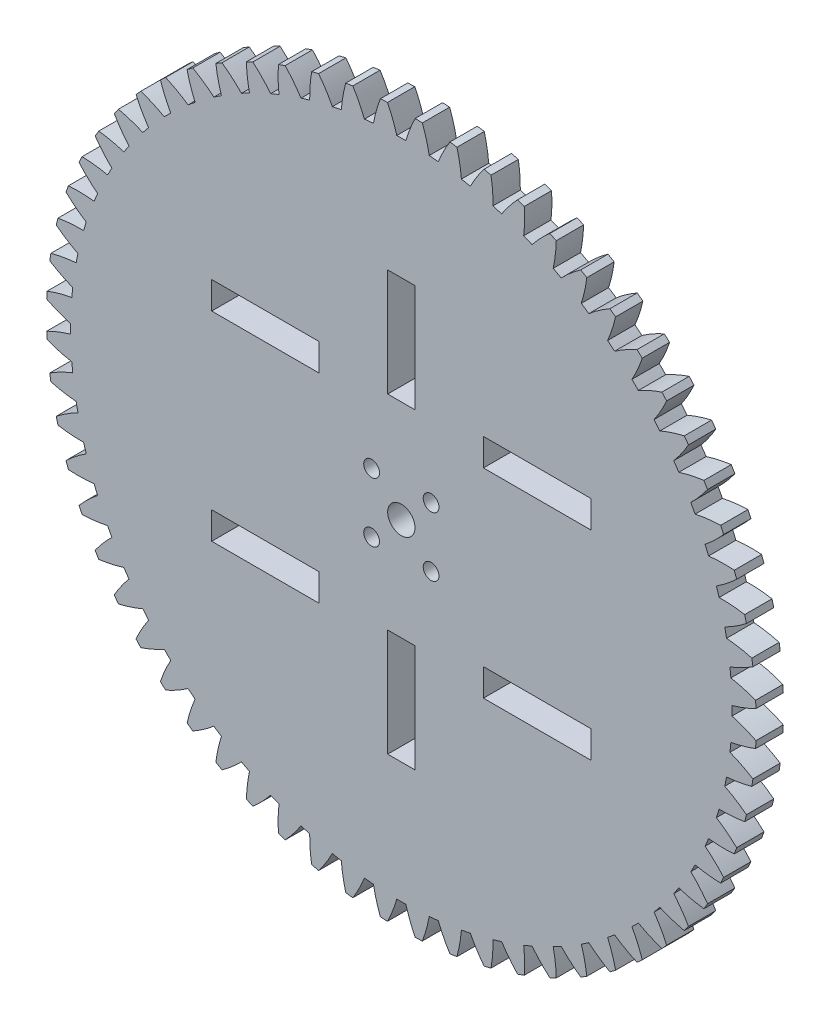
from build123d import *

# Parameters (mm, degrees)
BOSS_EXTRU_1_DEPTH      = 3.175
ENL_V_MAT_EXTRU_1_REACH = 118.756
ESQUISSE3_R             = 3.175
ESQUISSE3_R_2           = 1.83
SKETCH1_W               = 25
SKETCH1_H               = 6.35
SKETCH1_W_2             = 6.35
SKETCH1_H_2             = 25
CUT_EXTRUDE1_DEPTH      = 194.396732721


with BuildPart() as part:
    # Esquisse1 → Boss.-Extru.1 (new, symmetric)
    with BuildSketch(Plane.XY):
        with BuildLine():
            ThreePointArc((1.056408059, -76.866741039), (2.009334635, -79.702573965), (3.222927061, -82.437022879))
            ThreePointArc((3.222927061, -82.437022879), (4.048083132, -82.400625137), (4.872833454, -82.355968176))
            ThreePointArc((4.872833454, -82.355968176), (5.812559237, -79.515733521), (6.482936978, -76.600152768))
            ThreePointArc((6.482936978, -76.600152768), (7.534969646, -76.503830678), (8.585579309, -76.393060574))
            ThreePointArc((8.585579309, -76.393060574), (9.811877517, -79.121835051), (11.287649026, -81.724163988))
            ThreePointArc((11.287649026, -81.724163988), (12.105264143, -81.607062072), (12.921665919, -81.481780478))
            ThreePointArc((12.921665919, -81.481780478), (13.578474986, -78.563113096), (13.959847787, -75.595863152))
            ThreePointArc((13.959847787, -75.595863152), (14.997373415, -75.396887646), (16.032066736, -75.183673176))
            ThreePointArc((16.032066736, -75.183673176), (17.519926654, -77.779109614), (19.243664761, -80.224256722))
            ThreePointArc((19.243664761, -80.224256722), (20.045864842, -80.027578389), (20.846055677, -79.822878692))
            ThreePointArc((20.846055677, -79.822878692), (21.213622599, -76.853886945), (21.302317631, -73.863544049))
            ThreePointArc((21.302317631, -73.863544049), (22.315344279, -73.563831369), (23.324156597, -73.250225904))
            ThreePointArc((23.324156597, -73.250225904), (25.05924932, -75.687328832), (27.014353484, -77.951746009))
            ThreePointArc((27.014353484, -77.951746009), (27.793412905, -77.677385378), (28.569686523, -77.395238949))
            ThreePointArc((28.569686523, -77.395238949), (28.644471429, -74.404515849), (28.439634512, -71.419878639))
            ThreePointArc((28.439634512, -71.419878639), (29.41840618, -71.022315182), (30.391622079, -70.611338915))
            ThreePointArc((30.391622079, -70.611338915), (32.357237717, -72.866637699), (34.524879216, -74.928517369))
            ThreePointArc((34.524879216, -74.928517369), (35.273295208, -74.579116683), (36.018175671, -74.222240746))
            ThreePointArc((36.018175671, -74.222240746), (35.799458341, -71.238588593), (35.303062165, -68.288400756))
            ThreePointArc((35.303062165, -68.288400756), (36.238152747, -67.796815276), (37.166399628, -67.292426132))
            ThreePointArc((37.166399628, -67.292426132), (39.343608226, -69.344201012), (41.702911487, -71.183686147))
            ThreePointArc((41.702911487, -71.183686147), (42.413476396, -70.762610325), (43.119790097, -70.334441791))
            ThreePointArc((43.119790097, -70.334441791), (42.6096769, -67.386594786), (41.826502031, -64.499268243))
            ThreePointArc((41.826502031, -64.499268243), (42.708906093, -63.918394976), (43.58324443, -63.325450499))
            ThreePointArc((43.58324443, -63.325450499), (45.95107828, -65.153941762), (48.479321924, -66.753317114))
            ThreePointArc((48.479321924, -66.753317114), (49.145192621, -66.264621347), (49.806137373, -65.769283712))
            ThreePointArc((49.806137373, -65.769283712), (49.009540976, -62.885631233), (47.947129818, -60.088972517))
            ThreePointArc((47.947129818, -60.088972517), (48.768349327, -59.424405592), (49.580358764, -58.748616161))
            ThreePointArc((49.580358764, -58.748616161), (52.116014331, -60.336214436), (54.788849989, -61.680077147))
            ThreePointArc((54.788849989, -61.680077147), (55.403613775, -61.128467842), (56.012824319, -60.570731479))
            ThreePointArc((56.012824319, -60.570731479), (54.937416382, -57.779044675), (53.606000534, -55.099987139))
            ThreePointArc((53.606000534, -55.099987139), (54.358126697, -54.358126697), (55.099987139, -53.606000534))
            ThreePointArc((55.099987139, -53.606000534), (57.779044675, -54.937416382), (60.570731479, -56.012824319))
            ThreePointArc((60.570731479, -56.012824319), (61.128467842, -55.403613775), (61.680077147, -54.788849989))
            ThreePointArc((61.680077147, -54.788849989), (60.336214436, -52.116014331), (58.748616161, -49.580358764))
            ThreePointArc((58.748616161, -49.580358764), (59.424405592, -48.768349327), (60.088972517, -47.947129818))
            ThreePointArc((60.088972517, -47.947129818), (62.885631233, -49.009540976), (65.769283712, -49.806137373))
            ThreePointArc((65.769283712, -49.806137373), (66.264621347, -49.145192621), (66.753317114, -48.479321924))
            ThreePointArc((66.753317114, -48.479321924), (65.153941762, -45.95107828), (63.325450499, -43.58324443))
            ThreePointArc((63.325450499, -43.58324443), (63.918394976, -42.708906093), (64.499268243, -41.826502031))
            ThreePointArc((64.499268243, -41.826502031), (67.386594786, -42.6096769), (70.334441791, -43.119790097))
            ThreePointArc((70.334441791, -43.119790097), (70.762610325, -42.413476396), (71.183686147, -41.702911487))
            ThreePointArc((71.183686147, -41.702911487), (69.344201012, -39.343608226), (67.292426132, -37.166399628))
            ThreePointArc((67.292426132, -37.166399628), (67.796815276, -36.238152747), (68.288400756, -35.303062165))
            ThreePointArc((68.288400756, -35.303062165), (71.238588593, -35.799458341), (74.222240746, -36.018175671))
            ThreePointArc((74.222240746, -36.018175671), (74.579116683, -35.273295208), (74.928517369, -34.524879216))
            ThreePointArc((74.928517369, -34.524879216), (72.866637699, -32.357237717), (70.611338915, -30.391622079))
            ThreePointArc((70.611338915, -30.391622079), (71.022315182, -29.41840618), (71.419878639, -28.439634512))
            ThreePointArc((71.419878639, -28.439634512), (74.404515849, -28.644471429), (77.395238949, -28.569686523))
            ThreePointArc((77.395238949, -28.569686523), (77.677385378, -27.793412905), (77.951746009, -27.014353484))
            ThreePointArc((77.951746009, -27.014353484), (75.687328832, -25.05924932), (73.250225904, -23.324156597))
            ThreePointArc((73.250225904, -23.324156597), (73.563831369, -22.315344279), (73.863544049, -21.302317631))
            ThreePointArc((73.863544049, -21.302317631), (76.853886945, -21.213622599), (79.822878692, -20.846055677))
            ThreePointArc((79.822878692, -20.846055677), (80.027578389, -20.045864842), (80.224256722, -19.243664761))
            ThreePointArc((80.224256722, -19.243664761), (77.779109614, -17.519926654), (75.183673176, -16.032066736))
            ThreePointArc((75.183673176, -16.032066736), (75.396887646, -14.997373415), (75.595863152, -13.959847787))
            ThreePointArc((75.595863152, -13.959847787), (78.563113096, -13.578474986), (81.481780478, -12.921665919))
            ThreePointArc((81.481780478, -12.921665919), (81.607062072, -12.105264143), (81.724163988, -11.287649026))
            ThreePointArc((81.724163988, -11.287649026), (79.121835051, -9.811877517), (76.393060574, -8.585579309))
            ThreePointArc((76.393060574, -8.585579309), (76.503830678, -7.534969646), (76.600152768, -6.482936978))
            ThreePointArc((76.600152768, -6.482936978), (79.515733521, -5.812559237), (82.355968176, -4.872833454))
            ThreePointArc((82.355968176, -4.872833454), (82.400625137, -4.048083132), (82.437022879, -3.222927061))
            ThreePointArc((82.437022879, -3.222927061), (79.702573965, -2.009334635), (76.866741039, -1.056408059))
            ThreePointArc((76.866741039, -1.056408059), (76.874, 0), (76.866741039, 1.056408059))
            ThreePointArc((76.866741039, 1.056408059), (79.702573965, 2.009334635), (82.437022879, 3.222927061))
            ThreePointArc((82.437022879, 3.222927061), (82.400625137, 4.048083132), (82.355968176, 4.872833454))
            ThreePointArc((82.355968176, 4.872833454), (79.515733521, 5.812559237), (76.600152768, 6.482936978))
            ThreePointArc((76.600152768, 6.482936978), (76.503830678, 7.534969646), (76.393060574, 8.585579309))
            ThreePointArc((76.393060574, 8.585579309), (79.121835051, 9.811877517), (81.724163988, 11.287649026))
            ThreePointArc((81.724163988, 11.287649026), (81.607062072, 12.105264143), (81.481780478, 12.921665919))
            ThreePointArc((81.481780478, 12.921665919), (78.563113096, 13.578474986), (75.595863152, 13.959847787))
            ThreePointArc((75.595863152, 13.959847787), (75.396887646, 14.997373415), (75.183673176, 16.032066736))
            ThreePointArc((75.183673176, 16.032066736), (77.779109614, 17.519926654), (80.224256722, 19.243664761))
            ThreePointArc((80.224256722, 19.243664761), (80.027578389, 20.045864842), (79.822878692, 20.846055677))
            ThreePointArc((79.822878692, 20.846055677), (76.853886945, 21.213622599), (73.863544049, 21.302317631))
            ThreePointArc((73.863544049, 21.302317631), (73.563831369, 22.315344279), (73.250225904, 23.324156597))
            ThreePointArc((73.250225904, 23.324156597), (75.687328832, 25.05924932), (77.951746009, 27.014353484))
            ThreePointArc((77.951746009, 27.014353484), (77.677385378, 27.793412905), (77.395238949, 28.569686523))
            ThreePointArc((77.395238949, 28.569686523), (74.404515849, 28.644471429), (71.419878639, 28.439634512))
            ThreePointArc((71.419878639, 28.439634512), (71.022315182, 29.41840618), (70.611338915, 30.391622079))
            ThreePointArc((70.611338915, 30.391622079), (72.866637699, 32.357237717), (74.928517369, 34.524879216))
            ThreePointArc((74.928517369, 34.524879216), (74.579116683, 35.273295208), (74.222240746, 36.018175671))
            ThreePointArc((74.222240746, 36.018175671), (71.238588593, 35.799458341), (68.288400756, 35.303062165))
            ThreePointArc((68.288400756, 35.303062165), (67.796815276, 36.238152747), (67.292426132, 37.166399628))
            ThreePointArc((67.292426132, 37.166399628), (69.344201012, 39.343608226), (71.183686147, 41.702911487))
            ThreePointArc((71.183686147, 41.702911487), (70.762610325, 42.413476396), (70.334441791, 43.119790097))
            ThreePointArc((70.334441791, 43.119790097), (67.386594786, 42.6096769), (64.499268243, 41.826502031))
            ThreePointArc((64.499268243, 41.826502031), (63.918394976, 42.708906093), (63.325450499, 43.58324443))
            ThreePointArc((63.325450499, 43.58324443), (65.153941762, 45.95107828), (66.753317114, 48.479321924))
            ThreePointArc((66.753317114, 48.479321924), (66.264621347, 49.145192621), (65.769283712, 49.806137373))
            ThreePointArc((65.769283712, 49.806137373), (62.885631233, 49.009540976), (60.088972517, 47.947129818))
            ThreePointArc((60.088972517, 47.947129818), (59.424405592, 48.768349327), (58.748616161, 49.580358764))
            ThreePointArc((58.748616161, 49.580358764), (60.336214436, 52.116014331), (61.680077147, 54.788849989))
            ThreePointArc((61.680077147, 54.788849989), (61.128467842, 55.403613775), (60.570731479, 56.012824319))
            ThreePointArc((60.570731479, 56.012824319), (57.779044675, 54.937416382), (55.099987139, 53.606000534))
            ThreePointArc((55.099987139, 53.606000534), (54.358126697, 54.358126697), (53.606000534, 55.099987139))
            ThreePointArc((53.606000534, 55.099987139), (54.937416382, 57.779044675), (56.012824319, 60.570731479))
            ThreePointArc((56.012824319, 60.570731479), (55.403613775, 61.128467842), (54.788849989, 61.680077147))
            ThreePointArc((54.788849989, 61.680077147), (52.116014331, 60.336214436), (49.580358764, 58.748616161))
            ThreePointArc((49.580358764, 58.748616161), (48.768349327, 59.424405592), (47.947129818, 60.088972517))
            ThreePointArc((47.947129818, 60.088972517), (49.009540976, 62.885631233), (49.806137373, 65.769283712))
            ThreePointArc((49.806137373, 65.769283712), (49.145192621, 66.264621347), (48.479321924, 66.753317114))
            ThreePointArc((48.479321924, 66.753317114), (45.95107828, 65.153941762), (43.58324443, 63.325450499))
            ThreePointArc((43.58324443, 63.325450499), (42.708906093, 63.918394976), (41.826502031, 64.499268243))
            ThreePointArc((41.826502031, 64.499268243), (42.6096769, 67.386594786), (43.119790097, 70.334441791))
            ThreePointArc((43.119790097, 70.334441791), (42.413476396, 70.762610325), (41.702911487, 71.183686147))
            ThreePointArc((41.702911487, 71.183686147), (39.343608226, 69.344201012), (37.166399628, 67.292426132))
            ThreePointArc((37.166399628, 67.292426132), (36.238152747, 67.796815276), (35.303062165, 68.288400756))
            ThreePointArc((35.303062165, 68.288400756), (35.799458341, 71.238588593), (36.018175671, 74.222240746))
            ThreePointArc((36.018175671, 74.222240746), (35.273295208, 74.579116683), (34.524879216, 74.928517369))
            ThreePointArc((34.524879216, 74.928517369), (32.357237717, 72.866637699), (30.391622079, 70.611338915))
            ThreePointArc((30.391622079, 70.611338915), (29.41840618, 71.022315182), (28.439634512, 71.419878639))
            ThreePointArc((28.439634512, 71.419878639), (28.644471429, 74.404515849), (28.569686523, 77.395238949))
            ThreePointArc((28.569686523, 77.395238949), (27.793412905, 77.677385378), (27.014353484, 77.951746009))
            ThreePointArc((27.014353484, 77.951746009), (25.05924932, 75.687328832), (23.324156597, 73.250225904))
            ThreePointArc((23.324156597, 73.250225904), (22.315344279, 73.563831369), (21.302317631, 73.863544049))
            ThreePointArc((21.302317631, 73.863544049), (21.213622599, 76.853886945), (20.846055677, 79.822878692))
            ThreePointArc((20.846055677, 79.822878692), (20.045864842, 80.027578389), (19.243664761, 80.224256722))
            ThreePointArc((19.243664761, 80.224256722), (17.519926654, 77.779109614), (16.032066736, 75.183673176))
            ThreePointArc((16.032066736, 75.183673176), (14.997373415, 75.396887646), (13.959847787, 75.595863152))
            ThreePointArc((13.959847787, 75.595863152), (13.578474986, 78.563113096), (12.921665919, 81.481780478))
            ThreePointArc((12.921665919, 81.481780478), (12.105264143, 81.607062072), (11.287649026, 81.724163988))
            ThreePointArc((11.287649026, 81.724163988), (9.811877517, 79.121835051), (8.585579309, 76.393060574))
            ThreePointArc((8.585579309, 76.393060574), (7.534969646, 76.503830678), (6.482936978, 76.600152768))
            ThreePointArc((6.482936978, 76.600152768), (5.812559237, 79.515733521), (4.872833454, 82.355968176))
            ThreePointArc((4.872833454, 82.355968176), (4.048083132, 82.400625137), (3.222927061, 82.437022879))
            ThreePointArc((3.222927061, 82.437022879), (2.009334635, 79.702573965), (1.056408059, 76.866741039))
            ThreePointArc((1.056408059, 76.866741039), (0, 76.874), (-1.056408059, 76.866741039))
            ThreePointArc((-1.056408059, 76.866741039), (-2.009334635, 79.702573965), (-3.222927061, 82.437022879))
            ThreePointArc((-3.222927061, 82.437022879), (-4.048083132, 82.400625137), (-4.872833454, 82.355968176))
            ThreePointArc((-4.872833454, 82.355968176), (-5.812559237, 79.515733521), (-6.482936978, 76.600152768))
            ThreePointArc((-6.482936978, 76.600152768), (-7.534969646, 76.503830678), (-8.585579309, 76.393060574))
            ThreePointArc((-8.585579309, 76.393060574), (-9.811877517, 79.121835051), (-11.287649026, 81.724163988))
            ThreePointArc((-11.287649026, 81.724163988), (-12.105264143, 81.607062072), (-12.921665919, 81.481780478))
            ThreePointArc((-12.921665919, 81.481780478), (-13.578474986, 78.563113096), (-13.959847787, 75.595863152))
            ThreePointArc((-13.959847787, 75.595863152), (-14.997373415, 75.396887646), (-16.032066736, 75.183673176))
            ThreePointArc((-16.032066736, 75.183673176), (-17.519926654, 77.779109614), (-19.243664761, 80.224256722))
            ThreePointArc((-19.243664761, 80.224256722), (-20.045864842, 80.027578389), (-20.846055677, 79.822878692))
            ThreePointArc((-20.846055677, 79.822878692), (-21.213622599, 76.853886945), (-21.302317631, 73.863544049))
            ThreePointArc((-21.302317631, 73.863544049), (-22.315344279, 73.563831369), (-23.324156597, 73.250225904))
            ThreePointArc((-23.324156597, 73.250225904), (-25.05924932, 75.687328832), (-27.014353484, 77.951746009))
            ThreePointArc((-27.014353484, 77.951746009), (-27.793412905, 77.677385378), (-28.569686523, 77.395238949))
            ThreePointArc((-28.569686523, 77.395238949), (-28.644471429, 74.404515849), (-28.439634512, 71.419878639))
            ThreePointArc((-28.439634512, 71.419878639), (-29.41840618, 71.022315182), (-30.391622079, 70.611338915))
            ThreePointArc((-30.391622079, 70.611338915), (-32.357237717, 72.866637699), (-34.524879216, 74.928517369))
            ThreePointArc((-34.524879216, 74.928517369), (-35.273295208, 74.579116683), (-36.018175671, 74.222240746))
            ThreePointArc((-36.018175671, 74.222240746), (-35.799458341, 71.238588593), (-35.303062165, 68.288400756))
            ThreePointArc((-35.303062165, 68.288400756), (-36.238152747, 67.796815276), (-37.166399628, 67.292426132))
            ThreePointArc((-37.166399628, 67.292426132), (-39.343608226, 69.344201012), (-41.702911487, 71.183686147))
            ThreePointArc((-41.702911487, 71.183686147), (-42.413476396, 70.762610325), (-43.119790097, 70.334441791))
            ThreePointArc((-43.119790097, 70.334441791), (-42.6096769, 67.386594786), (-41.826502031, 64.499268243))
            ThreePointArc((-41.826502031, 64.499268243), (-42.708906093, 63.918394976), (-43.58324443, 63.325450499))
            ThreePointArc((-43.58324443, 63.325450499), (-45.95107828, 65.153941762), (-48.479321924, 66.753317114))
            ThreePointArc((-48.479321924, 66.753317114), (-49.145192621, 66.264621347), (-49.806137373, 65.769283712))
            ThreePointArc((-49.806137373, 65.769283712), (-49.009540976, 62.885631233), (-47.947129818, 60.088972517))
            ThreePointArc((-47.947129818, 60.088972517), (-48.768349327, 59.424405592), (-49.580358764, 58.748616161))
            ThreePointArc((-49.580358764, 58.748616161), (-52.116014331, 60.336214436), (-54.788849989, 61.680077147))
            ThreePointArc((-54.788849989, 61.680077147), (-55.403613775, 61.128467842), (-56.012824319, 60.570731479))
            ThreePointArc((-56.012824319, 60.570731479), (-54.937416382, 57.779044675), (-53.606000534, 55.099987139))
            ThreePointArc((-53.606000534, 55.099987139), (-54.358126697, 54.358126697), (-55.099987139, 53.606000534))
            ThreePointArc((-55.099987139, 53.606000534), (-57.779044675, 54.937416382), (-60.570731479, 56.012824319))
            ThreePointArc((-60.570731479, 56.012824319), (-61.128467842, 55.403613775), (-61.680077147, 54.788849989))
            ThreePointArc((-61.680077147, 54.788849989), (-60.336214436, 52.116014331), (-58.748616161, 49.580358764))
            ThreePointArc((-58.748616161, 49.580358764), (-59.424405592, 48.768349327), (-60.088972517, 47.947129818))
            ThreePointArc((-60.088972517, 47.947129818), (-62.885631233, 49.009540976), (-65.769283712, 49.806137373))
            ThreePointArc((-65.769283712, 49.806137373), (-66.264621347, 49.145192621), (-66.753317114, 48.479321924))
            ThreePointArc((-66.753317114, 48.479321924), (-65.153941762, 45.95107828), (-63.325450499, 43.58324443))
            ThreePointArc((-63.325450499, 43.58324443), (-63.918394976, 42.708906093), (-64.499268243, 41.826502031))
            ThreePointArc((-64.499268243, 41.826502031), (-67.386594786, 42.6096769), (-70.334441791, 43.119790097))
            ThreePointArc((-70.334441791, 43.119790097), (-70.762610325, 42.413476396), (-71.183686147, 41.702911487))
            ThreePointArc((-71.183686147, 41.702911487), (-69.344201012, 39.343608226), (-67.292426132, 37.166399628))
            ThreePointArc((-67.292426132, 37.166399628), (-67.796815276, 36.238152747), (-68.288400756, 35.303062165))
            ThreePointArc((-68.288400756, 35.303062165), (-71.238588593, 35.799458341), (-74.222240746, 36.018175671))
            ThreePointArc((-74.222240746, 36.018175671), (-74.579116683, 35.273295208), (-74.928517369, 34.524879216))
            ThreePointArc((-74.928517369, 34.524879216), (-72.866637699, 32.357237717), (-70.611338915, 30.391622079))
            ThreePointArc((-70.611338915, 30.391622079), (-71.022315182, 29.41840618), (-71.419878639, 28.439634512))
            ThreePointArc((-71.419878639, 28.439634512), (-74.404515849, 28.644471429), (-77.395238949, 28.569686523))
            ThreePointArc((-77.395238949, 28.569686523), (-77.677385378, 27.793412905), (-77.951746009, 27.014353484))
            ThreePointArc((-77.951746009, 27.014353484), (-75.687328832, 25.05924932), (-73.250225904, 23.324156597))
            ThreePointArc((-73.250225904, 23.324156597), (-73.563831369, 22.315344279), (-73.863544049, 21.302317631))
            ThreePointArc((-73.863544049, 21.302317631), (-76.853886945, 21.213622599), (-79.822878692, 20.846055677))
            ThreePointArc((-79.822878692, 20.846055677), (-80.027578389, 20.045864842), (-80.224256722, 19.243664761))
            ThreePointArc((-80.224256722, 19.243664761), (-77.779109614, 17.519926654), (-75.183673176, 16.032066736))
            ThreePointArc((-75.183673176, 16.032066736), (-75.396887646, 14.997373415), (-75.595863152, 13.959847787))
            ThreePointArc((-75.595863152, 13.959847787), (-78.563113096, 13.578474986), (-81.481780478, 12.921665919))
            ThreePointArc((-81.481780478, 12.921665919), (-81.607062072, 12.105264143), (-81.724163988, 11.287649026))
            ThreePointArc((-81.724163988, 11.287649026), (-79.121835051, 9.811877517), (-76.393060574, 8.585579309))
            ThreePointArc((-76.393060574, 8.585579309), (-76.503830678, 7.534969646), (-76.600152768, 6.482936978))
            ThreePointArc((-76.600152768, 6.482936978), (-79.515733521, 5.812559237), (-82.355968176, 4.872833454))
            ThreePointArc((-82.355968176, 4.872833454), (-82.400625137, 4.048083132), (-82.437022879, 3.222927061))
            ThreePointArc((-82.437022879, 3.222927061), (-79.702573965, 2.009334635), (-76.866741039, 1.056408059))
            ThreePointArc((-76.866741039, 1.056408059), (-76.874, 0), (-76.866741039, -1.056408059))
            ThreePointArc((-76.866741039, -1.056408059), (-79.702573965, -2.009334635), (-82.437022879, -3.222927061))
            ThreePointArc((-82.437022879, -3.222927061), (-82.400625137, -4.048083132), (-82.355968176, -4.872833454))
            ThreePointArc((-82.355968176, -4.872833454), (-79.515733521, -5.812559237), (-76.600152768, -6.482936978))
            ThreePointArc((-76.600152768, -6.482936978), (-76.503830678, -7.534969646), (-76.393060574, -8.585579309))
            ThreePointArc((-76.393060574, -8.585579309), (-79.121835051, -9.811877517), (-81.724163988, -11.287649026))
            ThreePointArc((-81.724163988, -11.287649026), (-81.607062072, -12.105264143), (-81.481780478, -12.921665919))
            ThreePointArc((-81.481780478, -12.921665919), (-78.563113096, -13.578474986), (-75.595863152, -13.959847787))
            ThreePointArc((-75.595863152, -13.959847787), (-75.396887646, -14.997373415), (-75.183673176, -16.032066736))
            ThreePointArc((-75.183673176, -16.032066736), (-77.779109614, -17.519926654), (-80.224256722, -19.243664761))
            ThreePointArc((-80.224256722, -19.243664761), (-80.027578389, -20.045864842), (-79.822878692, -20.846055677))
            ThreePointArc((-79.822878692, -20.846055677), (-76.853886945, -21.213622599), (-73.863544049, -21.302317631))
            ThreePointArc((-73.863544049, -21.302317631), (-73.563831369, -22.315344279), (-73.250225904, -23.324156597))
            ThreePointArc((-73.250225904, -23.324156597), (-75.687328832, -25.05924932), (-77.951746009, -27.014353484))
            ThreePointArc((-77.951746009, -27.014353484), (-77.677385378, -27.793412905), (-77.395238949, -28.569686523))
            ThreePointArc((-77.395238949, -28.569686523), (-74.404515849, -28.644471429), (-71.419878639, -28.439634512))
            ThreePointArc((-71.419878639, -28.439634512), (-71.022315182, -29.41840618), (-70.611338915, -30.391622079))
            ThreePointArc((-70.611338915, -30.391622079), (-72.866637699, -32.357237717), (-74.928517369, -34.524879216))
            ThreePointArc((-74.928517369, -34.524879216), (-74.579116683, -35.273295208), (-74.222240746, -36.018175671))
            ThreePointArc((-74.222240746, -36.018175671), (-71.238588593, -35.799458341), (-68.288400756, -35.303062165))
            ThreePointArc((-68.288400756, -35.303062165), (-67.796815276, -36.238152747), (-67.292426132, -37.166399628))
            ThreePointArc((-67.292426132, -37.166399628), (-69.344201012, -39.343608226), (-71.183686147, -41.702911487))
            ThreePointArc((-71.183686147, -41.702911487), (-70.762610325, -42.413476396), (-70.334441791, -43.119790097))
            ThreePointArc((-70.334441791, -43.119790097), (-67.386594786, -42.6096769), (-64.499268243, -41.826502031))
            ThreePointArc((-64.499268243, -41.826502031), (-63.918394976, -42.708906093), (-63.325450499, -43.58324443))
            ThreePointArc((-63.325450499, -43.58324443), (-65.153941762, -45.95107828), (-66.753317114, -48.479321924))
            ThreePointArc((-66.753317114, -48.479321924), (-66.264621347, -49.145192621), (-65.769283712, -49.806137373))
            ThreePointArc((-65.769283712, -49.806137373), (-62.885631233, -49.009540976), (-60.088972517, -47.947129818))
            ThreePointArc((-60.088972517, -47.947129818), (-59.424405592, -48.768349327), (-58.748616161, -49.580358764))
            ThreePointArc((-58.748616161, -49.580358764), (-60.336214436, -52.116014331), (-61.680077147, -54.788849989))
            ThreePointArc((-61.680077147, -54.788849989), (-61.128467842, -55.403613775), (-60.570731479, -56.012824319))
            ThreePointArc((-60.570731479, -56.012824319), (-57.779044675, -54.937416382), (-55.099987139, -53.606000534))
            ThreePointArc((-55.099987139, -53.606000534), (-54.358126697, -54.358126697), (-53.606000534, -55.099987139))
            ThreePointArc((-53.606000534, -55.099987139), (-54.937416382, -57.779044675), (-56.012824319, -60.570731479))
            ThreePointArc((-56.012824319, -60.570731479), (-55.403613775, -61.128467842), (-54.788849989, -61.680077147))
            ThreePointArc((-54.788849989, -61.680077147), (-52.116014331, -60.336214436), (-49.580358764, -58.748616161))
            ThreePointArc((-49.580358764, -58.748616161), (-48.768349327, -59.424405592), (-47.947129818, -60.088972517))
            ThreePointArc((-47.947129818, -60.088972517), (-49.009540976, -62.885631233), (-49.806137373, -65.769283712))
            ThreePointArc((-49.806137373, -65.769283712), (-49.145192621, -66.264621347), (-48.479321924, -66.753317114))
            ThreePointArc((-48.479321924, -66.753317114), (-45.95107828, -65.153941762), (-43.58324443, -63.325450499))
            ThreePointArc((-43.58324443, -63.325450499), (-42.708906093, -63.918394976), (-41.826502031, -64.499268243))
            ThreePointArc((-41.826502031, -64.499268243), (-42.6096769, -67.386594786), (-43.119790097, -70.334441791))
            ThreePointArc((-43.119790097, -70.334441791), (-42.413476396, -70.762610325), (-41.702911487, -71.183686147))
            ThreePointArc((-41.702911487, -71.183686147), (-39.343608226, -69.344201012), (-37.166399628, -67.292426132))
            ThreePointArc((-37.166399628, -67.292426132), (-36.238152747, -67.796815276), (-35.303062165, -68.288400756))
            ThreePointArc((-35.303062165, -68.288400756), (-35.799458341, -71.238588593), (-36.018175671, -74.222240746))
            ThreePointArc((-36.018175671, -74.222240746), (-35.273295208, -74.579116683), (-34.524879216, -74.928517369))
            ThreePointArc((-34.524879216, -74.928517369), (-32.357237717, -72.866637699), (-30.391622079, -70.611338915))
            ThreePointArc((-30.391622079, -70.611338915), (-29.41840618, -71.022315182), (-28.439634512, -71.419878639))
            ThreePointArc((-28.439634512, -71.419878639), (-28.644471429, -74.404515849), (-28.569686523, -77.395238949))
            ThreePointArc((-28.569686523, -77.395238949), (-27.793412905, -77.677385378), (-27.014353484, -77.951746009))
            ThreePointArc((-27.014353484, -77.951746009), (-25.05924932, -75.687328832), (-23.324156597, -73.250225904))
            ThreePointArc((-23.324156597, -73.250225904), (-22.315344279, -73.563831369), (-21.302317631, -73.863544049))
            ThreePointArc((-21.302317631, -73.863544049), (-21.213622599, -76.853886945), (-20.846055677, -79.822878692))
            ThreePointArc((-20.846055677, -79.822878692), (-20.045864842, -80.027578389), (-19.243664761, -80.224256722))
            ThreePointArc((-19.243664761, -80.224256722), (-17.519926654, -77.779109614), (-16.032066736, -75.183673176))
            ThreePointArc((-16.032066736, -75.183673176), (-14.997373415, -75.396887646), (-13.959847787, -75.595863152))
            ThreePointArc((-13.959847787, -75.595863152), (-13.578474986, -78.563113096), (-12.921665919, -81.481780478))
            ThreePointArc((-12.921665919, -81.481780478), (-12.105264143, -81.607062072), (-11.287649026, -81.724163988))
            ThreePointArc((-11.287649026, -81.724163988), (-9.811877517, -79.121835051), (-8.585579309, -76.393060574))
            ThreePointArc((-8.585579309, -76.393060574), (-7.534969646, -76.503830678), (-6.482936978, -76.600152768))
            ThreePointArc((-6.482936978, -76.600152768), (-5.812559237, -79.515733521), (-4.872833454, -82.355968176))
            ThreePointArc((-4.872833454, -82.355968176), (-4.048083132, -82.400625137), (-3.222927061, -82.437022879))
            ThreePointArc((-3.222927061, -82.437022879), (-2.009334635, -79.702573965), (-1.056408059, -76.866741039))
            ThreePointArc((-1.056408059, -76.866741039), (0, -76.874), (1.056408059, -76.866741039))
        make_face()
    extrude(amount=BOSS_EXTRU_1_DEPTH, both=True)

    # Esquisse3 → Enlèv. mat.-Extru.1 (cut, up to next)
    with BuildSketch(Plane.XY.offset(3.175), mode=Mode.PRIVATE) as enl_v_mat_extru_1_sk1:
        Circle(ESQUISSE3_R)
    enl_v_mat_extru_1_tool1 = extrude(enl_v_mat_extru_1_sk1.sketch, amount=-ENL_V_MAT_EXTRU_1_REACH, mode=Mode.PRIVATE) & part.part
    # Esquisse3 → Enlèv. mat.-Extru.1 (cut, up to next)
    with BuildSketch(Plane.XY.offset(3.175), mode=Mode.PRIVATE) as enl_v_mat_extru_1_sk2:
        with Locations((-6.914797213, -6.914797213)):
            Circle(ESQUISSE3_R_2)
    enl_v_mat_extru_1_tool2 = extrude(enl_v_mat_extru_1_sk2.sketch, amount=-ENL_V_MAT_EXTRU_1_REACH, mode=Mode.PRIVATE) & part.part
    # Esquisse3 → Enlèv. mat.-Extru.1 (cut, up to next)
    with BuildSketch(Plane.XY.offset(3.175), mode=Mode.PRIVATE) as enl_v_mat_extru_1_sk3:
        with Locations((-6.914797213, 6.914797213)):
            Circle(ESQUISSE3_R_2)
    enl_v_mat_extru_1_tool3 = extrude(enl_v_mat_extru_1_sk3.sketch, amount=-ENL_V_MAT_EXTRU_1_REACH, mode=Mode.PRIVATE) & part.part
    # Esquisse3 → Enlèv. mat.-Extru.1 (cut, up to next)
    with BuildSketch(Plane.XY.offset(3.175), mode=Mode.PRIVATE) as enl_v_mat_extru_1_sk4:
        with Locations((6.914797213, 6.914797213)):
            Circle(ESQUISSE3_R_2)
    enl_v_mat_extru_1_tool4 = extrude(enl_v_mat_extru_1_sk4.sketch, amount=-ENL_V_MAT_EXTRU_1_REACH, mode=Mode.PRIVATE) & part.part
    # Esquisse3 → Enlèv. mat.-Extru.1 (cut, up to next)
    with BuildSketch(Plane.XY.offset(3.175), mode=Mode.PRIVATE) as enl_v_mat_extru_1_sk5:
        with Locations((6.914797213, -6.914797213)):
            Circle(ESQUISSE3_R_2)
    enl_v_mat_extru_1_tool5 = extrude(enl_v_mat_extru_1_sk5.sketch, amount=-ENL_V_MAT_EXTRU_1_REACH, mode=Mode.PRIVATE) & part.part
    add(enl_v_mat_extru_1_tool1.solids().sort_by_distance((0, 0, 3.175))[0], mode=Mode.SUBTRACT)
    add(enl_v_mat_extru_1_tool2.solids().sort_by_distance((-6.914797, -6.914797, 3.175))[0], mode=Mode.SUBTRACT)
    add(enl_v_mat_extru_1_tool3.solids().sort_by_distance((-6.914797, 6.914797, 3.175))[0], mode=Mode.SUBTRACT)
    add(enl_v_mat_extru_1_tool4.solids().sort_by_distance((6.914797, 6.914797, 3.175))[0], mode=Mode.SUBTRACT)
    add(enl_v_mat_extru_1_tool5.solids().sort_by_distance((6.914797, -6.914797, 3.175))[0], mode=Mode.SUBTRACT)

    # Sketch1 → Cut-Extrude1 (cut, through all)
    with BuildSketch(Plane(origin=(-58.748616161, 49.580358764, 3.175), x_dir=(-1, 0, 0), z_dir=(0, 0, -1))):
        with Locations((-90.336116161, -72.755358764)):
            Rectangle(SKETCH1_W, SKETCH1_H)
        with Locations((-90.336116161, -26.405358764)):
            Rectangle(SKETCH1_W, SKETCH1_H)
        with Locations((-58.748616161, -85.830358764)):
            Rectangle(SKETCH1_W_2, SKETCH1_H_2)
        with Locations((-58.748616161, -13.330358764)):
            Rectangle(SKETCH1_W_2, SKETCH1_H_2)
        with Locations((-27.161116161, -26.405358764)):
            Rectangle(SKETCH1_W, SKETCH1_H)
        with Locations((-27.161116161, -72.755358764)):
            Rectangle(SKETCH1_W, SKETCH1_H)
    extrude(amount=CUT_EXTRUDE1_DEPTH, mode=Mode.SUBTRACT)


solid = part.part
